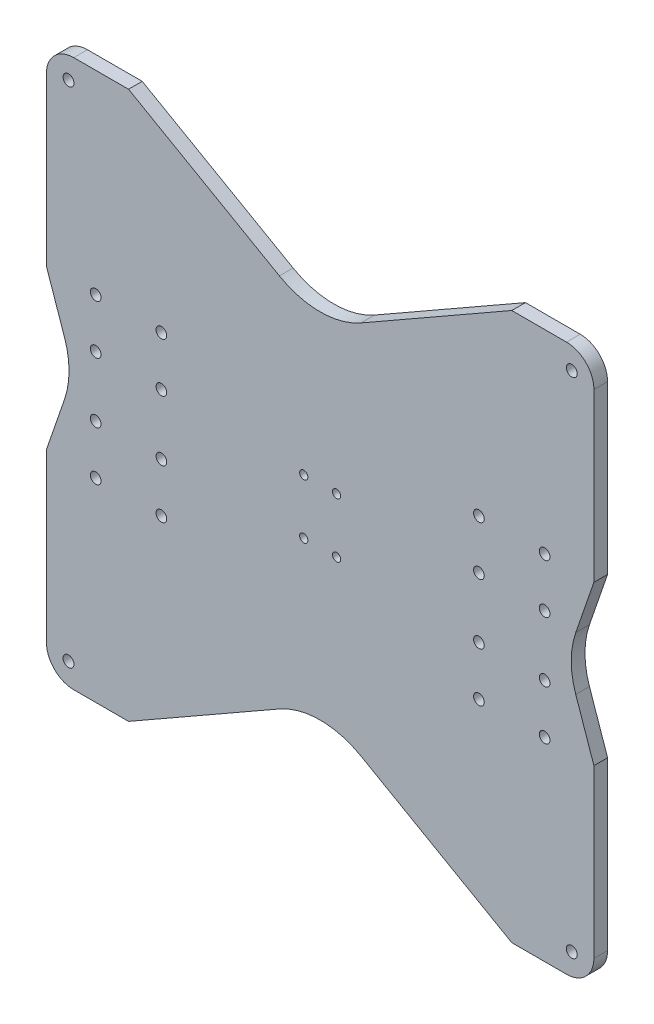
from build123d import *

# Parameters (mm, degrees)
SKETCH1_R           = 2
SKETCH1_R_2         = 1.95
SKETCH1_R_3         = 1.5
BOSS_EXTRUDE1_DEPTH = 5


with BuildPart() as part:
    # Sketch1 → Boss-Extrude1 (new body)
    with BuildSketch(Plane.XY):
        with BuildLine():
            Line((-90, 100), (-70, 100))
            Line((-70, 100), (-14.884168151, 68.505238943))
            ThreePointArc((-14.884168151, 68.505238943), (0, 64.552533207), (14.884168151, 68.505238943))
            Line((14.884168151, 68.505238943), (70, 100))
            Line((70, 100), (90, 100))
            ThreePointArc((90, 100), (97.071067812, 97.071067812), (100, 90))
            Line((100, 90), (100, 29))
            Line((100, 29), (93.372317414, 9.7797205))
            ThreePointArc((93.372317414, 9.7797205), (91.733506862, 0), (93.372317414, -9.7797205))
            Line((93.372317414, -9.7797205), (100, -29))
            Line((100, -29), (100, -90))
            ThreePointArc((100, -90), (97.071067812, -97.071067812), (90, -100))
            Line((90, -100), (70, -100))
            Line((70, -100), (14.884168151, -68.505238943))
            ThreePointArc((14.884168151, -68.505238943), (0, -64.552533207), (-14.884168151, -68.505238943))
            Line((-14.884168151, -68.505238943), (-70, -100))
            Line((-70, -100), (-90, -100))
            ThreePointArc((-90, -100), (-97.071067812, -97.071067812), (-100, -90))
            Line((-100, -90), (-100, -29))
            Line((-100, -29), (-93.372317414, -9.7797205))
            ThreePointArc((-93.372317414, -9.7797205), (-91.733506862, 0), (-93.372317414, 9.7797205))
            Line((-93.372317414, 9.7797205), (-100, 29))
            Line((-100, 29), (-100, 90))
            ThreePointArc((-100, 90), (-97.071067812, 97.071067812), (-90, 100))
        make_face()
        with Locations((-91.923881554, 91.923881554)):
            Circle(SKETCH1_R, mode=Mode.SUBTRACT)
        with Locations((91.923881554, 91.923881554)):
            Circle(SKETCH1_R, mode=Mode.SUBTRACT)
        with Locations((91.923881554, -91.923881554)):
            Circle(SKETCH1_R, mode=Mode.SUBTRACT)
        with Locations((-91.923881554, -91.923881554)):
            Circle(SKETCH1_R, mode=Mode.SUBTRACT)
        with Locations((58, 29)):
            Circle(SKETCH1_R_2, mode=Mode.SUBTRACT)
        with Locations((82, 29)):
            Circle(SKETCH1_R_2, mode=Mode.SUBTRACT)
        with Locations((58, 11)):
            Circle(SKETCH1_R_2, mode=Mode.SUBTRACT)
        with Locations((82, 11)):
            Circle(SKETCH1_R_2, mode=Mode.SUBTRACT)
        with Locations((58, -11)):
            Circle(SKETCH1_R_2, mode=Mode.SUBTRACT)
        with Locations((58, -29)):
            Circle(SKETCH1_R_2, mode=Mode.SUBTRACT)
        with Locations((82, -11)):
            Circle(SKETCH1_R_2, mode=Mode.SUBTRACT)
        with Locations((82, -29)):
            Circle(SKETCH1_R_2, mode=Mode.SUBTRACT)
        with Locations((-82, 29)):
            Circle(SKETCH1_R_2, mode=Mode.SUBTRACT)
        with Locations((-58, 29)):
            Circle(SKETCH1_R_2, mode=Mode.SUBTRACT)
        with Locations((-82, 11)):
            Circle(SKETCH1_R_2, mode=Mode.SUBTRACT)
        with Locations((-58, 11)):
            Circle(SKETCH1_R_2, mode=Mode.SUBTRACT)
        with Locations((-82, -11)):
            Circle(SKETCH1_R_2, mode=Mode.SUBTRACT)
        with Locations((-82, -29)):
            Circle(SKETCH1_R_2, mode=Mode.SUBTRACT)
        with Locations((-58, -11)):
            Circle(SKETCH1_R_2, mode=Mode.SUBTRACT)
        with Locations((-58, -29)):
            Circle(SKETCH1_R_2, mode=Mode.SUBTRACT)
        with Locations((-6, 10)):
            Circle(SKETCH1_R_3, mode=Mode.SUBTRACT)
        with Locations((6, 10)):
            Circle(SKETCH1_R_3, mode=Mode.SUBTRACT)
        with Locations((-6, -10)):
            Circle(SKETCH1_R_3, mode=Mode.SUBTRACT)
        with Locations((6, -10)):
            Circle(SKETCH1_R_3, mode=Mode.SUBTRACT)
    extrude(amount=BOSS_EXTRUDE1_DEPTH)


solid = part.part
